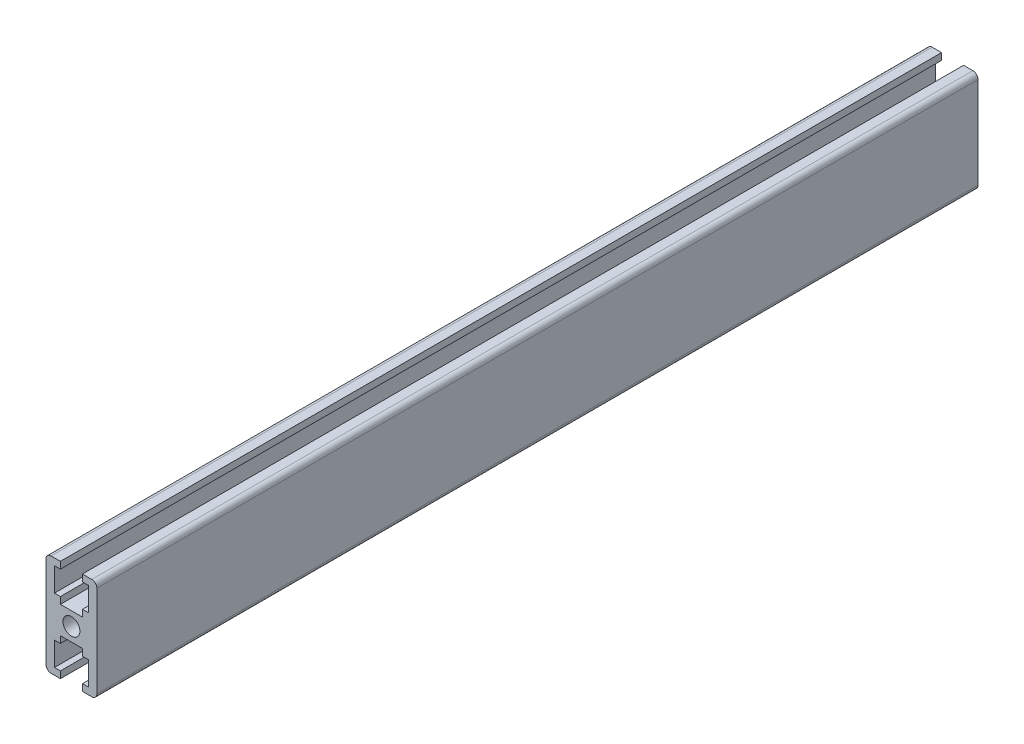
from build123d import *

# Parameters (mm, degrees)
SKETCH1_R              = 2.5
EXTRUDE_1_DEPTH        = 260
HOLE_WIZARD_M6_1_D     = 5
HOLE_WIZARD_M6_1_DEPTH = 20
HOLE_WIZARD_M6_1_TIP   = 1.502151548
HOLE_WIZARD_M6_2_D     = 5
HOLE_WIZARD_M6_2_DEPTH = 20
HOLE_WIZARD_M6_2_TIP   = 1.502151548


with BuildPart() as part:
    # Sketch1 → 凸台-拉伸1 (new body)
    with BuildSketch(Plane.XY):
        with BuildLine():
            Line((-6, -15), (-3.25, -15))
            Line((-3.25, -15), (-3.25, -13))
            Line((-3.25, -13), (-5, -13))
            Line((-5, -13), (-5, -6))
            Line((-5, -6), (-3.25, -6))
            Line((-3.25, -6), (-3.25, -4))
            Line((-3.25, -4), (3.25, -4))
            Line((3.25, -4), (3.25, -6))
            Line((3.25, -6), (5, -6))
            Line((5, -6), (5, -13))
            Line((5, -13), (3.25, -13))
            Line((3.25, -13), (3.25, -15))
            Line((3.25, -15), (6, -15))
            ThreePointArc((6, -15), (7.060660172, -14.560660172), (7.5, -13.5))
            Line((7.5, -13.5), (7.5, 13.5))
            ThreePointArc((7.5, 13.5), (7.060660172, 14.560660172), (6, 15))
            Line((6, 15), (3.25, 15))
            Line((3.25, 15), (3.25, 13))
            Line((3.25, 13), (5, 13))
            Line((5, 13), (5, 6))
            Line((5, 6), (3.25, 6))
            Line((3.25, 6), (3.25, 4))
            Line((3.25, 4), (-3.25, 4))
            Line((-3.25, 4), (-3.25, 6))
            Line((-3.25, 6), (-5, 6))
            Line((-5, 6), (-5, 13))
            Line((-5, 13), (-3.25, 13))
            Line((-3.25, 13), (-3.25, 15))
            Line((-3.25, 15), (-6, 15))
            ThreePointArc((-6, 15), (-7.060660172, 14.560660172), (-7.5, 13.5))
            Line((-7.5, 13.5), (-7.5, -13.5))
            ThreePointArc((-7.5, -13.5), (-7.060660172, -14.560660172), (-6, -15))
        make_face()
        Circle(SKETCH1_R, mode=Mode.SUBTRACT)
    extrude(amount=EXTRUDE_1_DEPTH)

    # M6 螺纹孔1
    with Locations(Plane.XY.offset(260)):
        with Locations((0, 0)):
            Hole(HOLE_WIZARD_M6_1_D / 2, depth=HOLE_WIZARD_M6_1_DEPTH)
            with Locations((0, 0, -(HOLE_WIZARD_M6_1_DEPTH + HOLE_WIZARD_M6_1_TIP / 2))):  # 118° drill point
                Cone(0, HOLE_WIZARD_M6_1_D / 2, HOLE_WIZARD_M6_1_TIP, mode=Mode.SUBTRACT)

    # M6 螺纹孔2
    with Locations(Plane(origin=(0, 0, 0), x_dir=(-1, 0, 0), z_dir=(0, 0, -1))):
        with Locations((0, 0)):
            Hole(HOLE_WIZARD_M6_2_D / 2, depth=HOLE_WIZARD_M6_2_DEPTH)
            with Locations((0, 0, -(HOLE_WIZARD_M6_2_DEPTH + HOLE_WIZARD_M6_2_TIP / 2))):  # 118° drill point
                Cone(0, HOLE_WIZARD_M6_2_D / 2, HOLE_WIZARD_M6_2_TIP, mode=Mode.SUBTRACT)


solid = part.part
